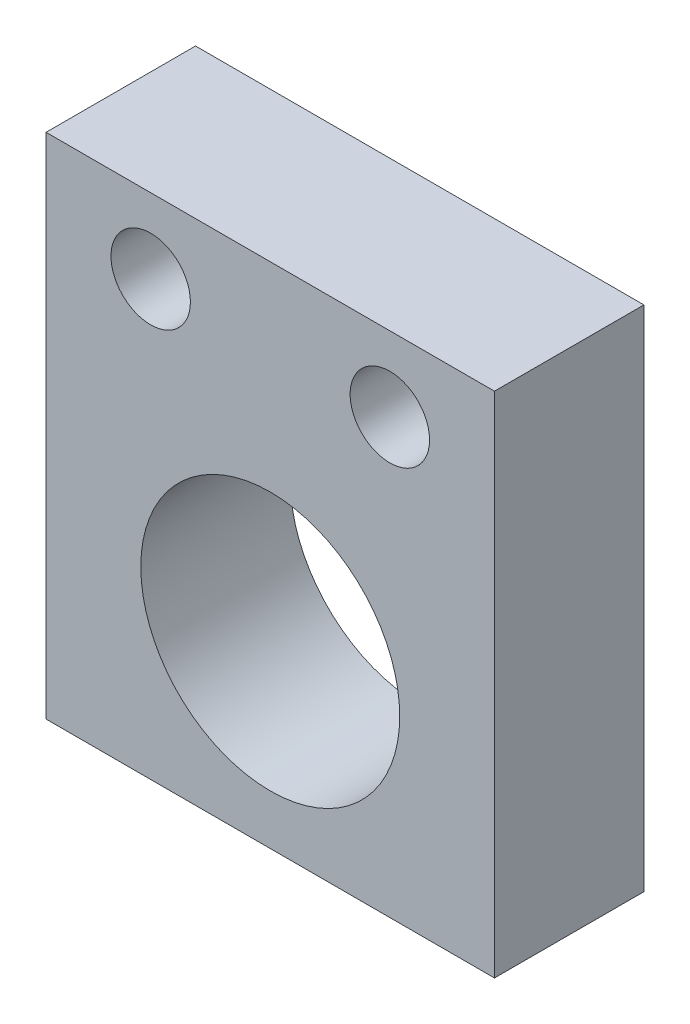
from build123d import *

# Parameters (mm, degrees)
SKETCH1_W                        = 38.1
SKETCH1_H                        = 43.18
BOSS_EXTRUDE1_DEPTH              = 12.7
SKETCH3_R                        = 11
CUT_EXTRUDE1_DEPTH               = 59.969588773
F_17_64_0_26563_DIAMETER_HOLE1_D = 6.747002
F_1_4_20_TAPPED_HOLE2_D          = 5.1054
F_1_4_20_TAPPED_HOLE2_DEPTH      = 12.7
F_1_4_20_TAPPED_HOLE2_TIP        = 1.533816902


with BuildPart() as part:
    # Sketch1 → Boss-Extrude1 (new body)
    with BuildSketch(Plane.XY):
        with Locations((19.05, 21.59)):
            Rectangle(SKETCH1_W, SKETCH1_H)
    extrude(amount=-BOSS_EXTRUDE1_DEPTH)

    # Sketch3 → Cut-Extrude1 (cut, through all)
    with BuildSketch(Plane.XY):
        with Locations((19.05, 15.24)):
            Circle(SKETCH3_R)
    extrude(amount=-CUT_EXTRUDE1_DEPTH, mode=Mode.SUBTRACT)

    # 17/64 (0.26563) Diameter Hole1 (through all)
    with Locations(Plane(origin=(29.21, 36.83, 0), x_dir=(1, 0, 0), z_dir=(0, 0, 1))):
        with Locations((0, 0), (-20.32, 0)):
            Hole(F_17_64_0_26563_DIAMETER_HOLE1_D / 2)

    # 1/4-20 Tapped Hole2
    with Locations(Plane(origin=(0, 27.94, -6.35), x_dir=(0, 0, -1), z_dir=(-1, 0, 0))):
        with Locations((0, 0)):
            Hole(F_1_4_20_TAPPED_HOLE2_D / 2, depth=F_1_4_20_TAPPED_HOLE2_DEPTH)
            with Locations((0, 0, -(F_1_4_20_TAPPED_HOLE2_DEPTH + F_1_4_20_TAPPED_HOLE2_TIP / 2))):  # 118° drill point
                Cone(0, F_1_4_20_TAPPED_HOLE2_D / 2, F_1_4_20_TAPPED_HOLE2_TIP, mode=Mode.SUBTRACT)


solid = part.part
